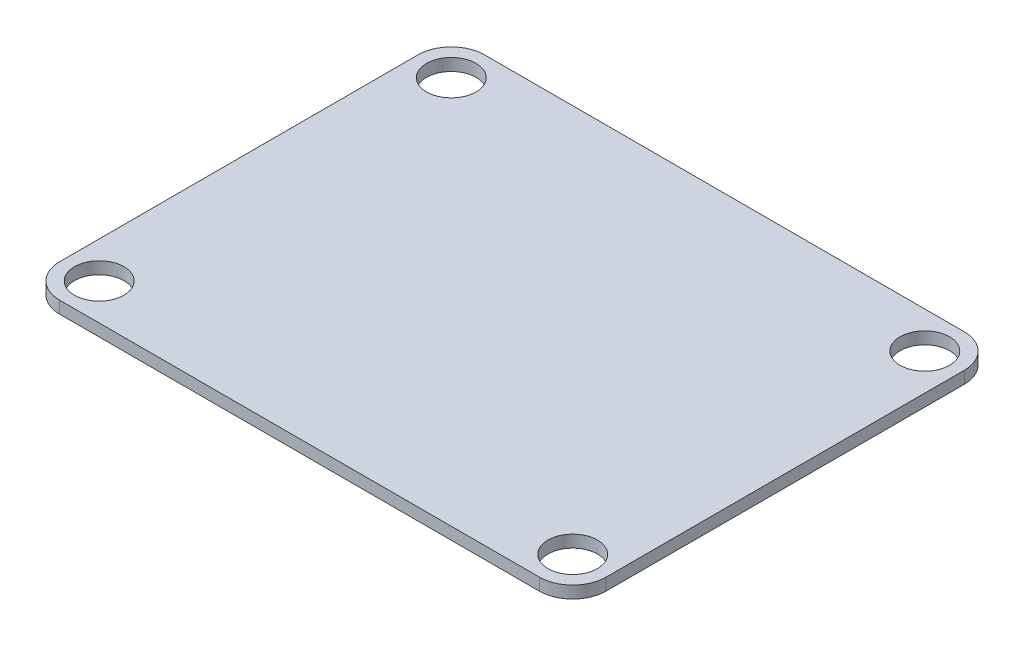
from build123d import *

# Parameters (mm, degrees)
SKETCH1_W           = 228.6
SKETCH1_H           = 177.8
BOSS_EXTRUDE1_DEPTH = 5.08
SKETCH2_R           = 10.3505
CUT_EXTRUDE1_DEPTH  = 145.891360681
FILLET3_R           = 13.97


with BuildPart() as part:
    # Sketch1 → Boss-Extrude1 (new body)
    with BuildSketch(Plane(origin=(0, 0, 0), x_dir=(1, 0, 0), z_dir=(0, 1, 0))):
        Rectangle(SKETCH1_W, SKETCH1_H)
    extrude(amount=BOSS_EXTRUDE1_DEPTH)

    # Sketch2 → Cut-Extrude1 (cut, through all)
    with BuildSketch(Plane(origin=(0, 5.08, 0), x_dir=(1, 0, 0), z_dir=(0, 1, 0))):
        with Locations(Location((-99.06, 73.66, 0), (0, 0, 270))):
            Circle(SKETCH2_R)
        with Locations(Location((99.06, 73.66, 0), (0, 0, 270))):
            Circle(SKETCH2_R)
        with Locations(Location((99.06, -73.66, 0), (0, 0, 270))):
            Circle(SKETCH2_R)
        with Locations(Location((-99.06, -73.66, 0), (0, 0, 270))):
            Circle(SKETCH2_R)
    extrude(amount=-CUT_EXTRUDE1_DEPTH, mode=Mode.SUBTRACT)

    # Fillet3
    fillet3_edges = [part.edges().sort_by_distance(p)[0] for p in [
        (114.3, 2.54, 88.9),
        (-114.3, 2.54, 88.9),
        (-114.3, 2.54, -88.9),
        (114.3, 2.54, -88.9),
    ]]
    fillet(fillet3_edges, radius=FILLET3_R)


solid = part.part
